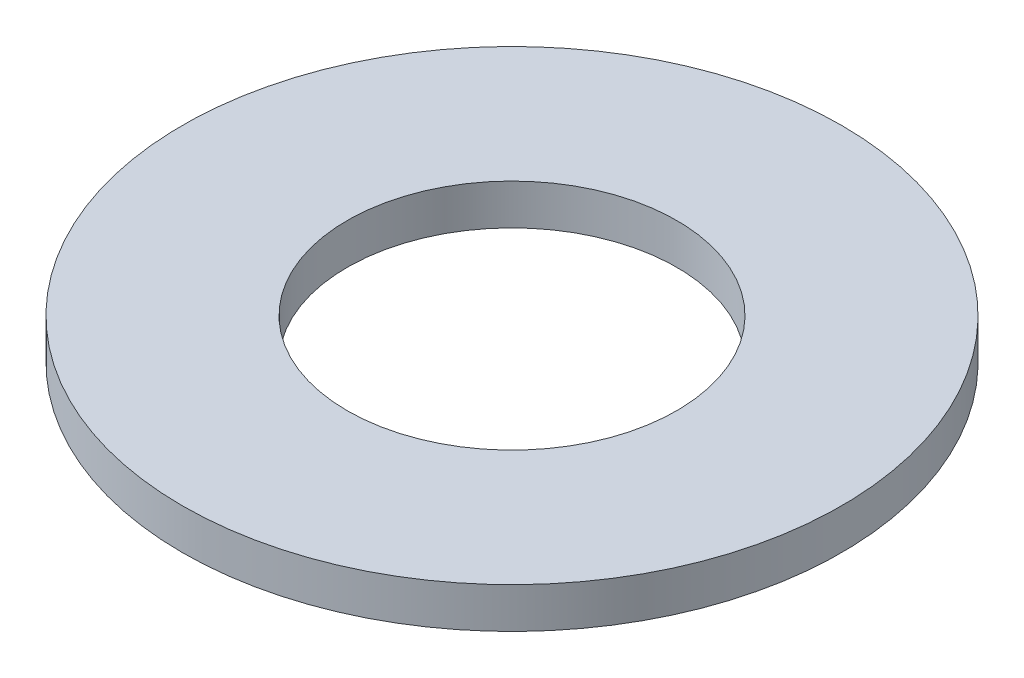
from build123d import *

# Parameters (mm, degrees)
SKETCH1_R           = 6.5
SKETCH1_R_2         = 3.25
BOSS_EXTRUDE1_DEPTH = 0.8


with BuildPart() as part:
    # Sketch1 → Boss-Extrude1 (new body)
    with BuildSketch(Plane(origin=(0, 0, 0), x_dir=(1, 0, 0), z_dir=(0, 1, 0))):
        with Locations(Location((0, 0, 0), (0, 0, 270))):
            Circle(SKETCH1_R)
        with Locations(Location((0, 0, 0), (0, 0, 270))):
            Circle(SKETCH1_R_2, mode=Mode.SUBTRACT)
    extrude(amount=BOSS_EXTRUDE1_DEPTH)


solid = part.part
